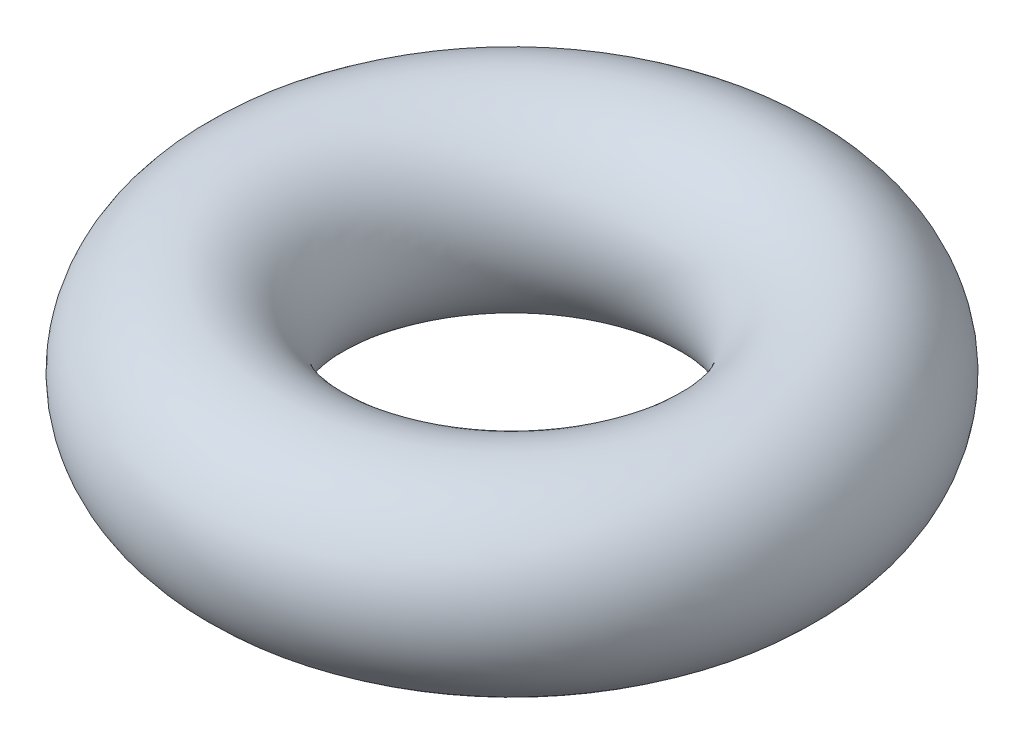
from build123d import *

# Parameters (mm, degrees)
SKETCH1_R = 2


with BuildPart() as part:
    # Sketch1 → Revolve1 (revolve)
    with BuildSketch(Plane.XY, mode=Mode.PRIVATE) as revolve1_sk:
        with Locations((5, 0)):
            Circle(SKETCH1_R)
    revolve(revolve1_sk.sketch.rotate(Axis((0, -3, 0), (0, 1, 0)), 90), axis=Axis((0, -3, 0), (0, 1, 0)))


solid = part.part
